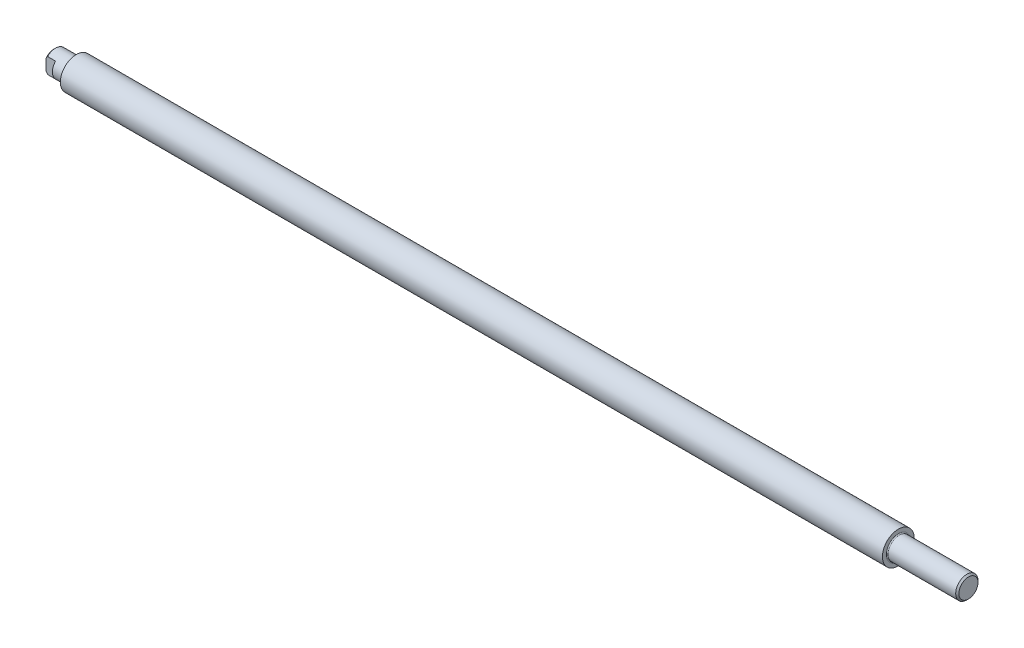
from build123d import *

# Parameters (mm, degrees)
SKETCH1_W           = 258
SKETCH1_H           = 5
SKETCH2_R           = 3.5
BOSS_EXTRUDE1_DEPTH = 7
CUT_EXTRUDE1_START  = -3
CUT_EXTRUDE1_DEPTH  = 3
BOSS_EXTRUDE2_START = 22
SKETCH4_R           = 3.5
BOSS_EXTRUDE2_DEPTH = 22
CHAMFER1_SIZE       = 0.5
FILLET1_R           = 0.3


with BuildPart() as part:
    # Sketch1 → Revolve1 (revolve)
    with BuildSketch(Plane.XY, mode=Mode.PRIVATE) as revolve1_sk:
        with Locations((136, 2.5)):
            Rectangle(SKETCH1_W, SKETCH1_H)
    revolve(revolve1_sk.sketch.rotate(Axis((7, 0, 0), (1, 0, 0)), 270), axis=Axis((7, 0, 0), (1, 0, 0)))

    # Sketch2 → Boss-Extrude1 (add)
    with BuildSketch(Plane.ZY.offset(-7)):
        Circle(SKETCH2_R)
    extrude(amount=BOSS_EXTRUDE1_DEPTH)

    # Sketch3 → Cut-Extrude1 (cut)
    with BuildSketch(Plane.ZY.offset(CUT_EXTRUDE1_START)):
        with BuildLine():
            Line((2.5, 2.449489743), (2.5, -2.449489743))
            ThreePointArc((2.5, -2.449489743), (3.5, 0), (2.5, 2.449489743))
        make_face()
    extrude(amount=CUT_EXTRUDE1_DEPTH, mode=Mode.SUBTRACT)

    # Sketch4 → Boss-Extrude2 (add)
    with BuildSketch(Plane(origin=(265, 0, 0), x_dir=(0, 0, -1), z_dir=(1, 0, 0)).offset(BOSS_EXTRUDE2_START)):
        with Locations(Location((0, 0, 0), (0, 0, 135.584691403))):
            Circle(SKETCH4_R)
    extrude(amount=-BOSS_EXTRUDE2_DEPTH)

    # Chamfer1
    chamfer1_edges = [part.edges().sort_by_distance(p)[0] for p in [
        (287, -2.449489743, -2.5),
        (0, 0, -3.5),
    ]]
    chamfer(chamfer1_edges, length=CHAMFER1_SIZE)

    # Fillet1
    fillet1_edges = [part.edges().sort_by_distance(p)[0] for p in [
        (265, -2.449489743, -2.5),
        (7, 0, -3.5),
    ]]
    fillet(fillet1_edges, radius=FILLET1_R)


solid = part.part
